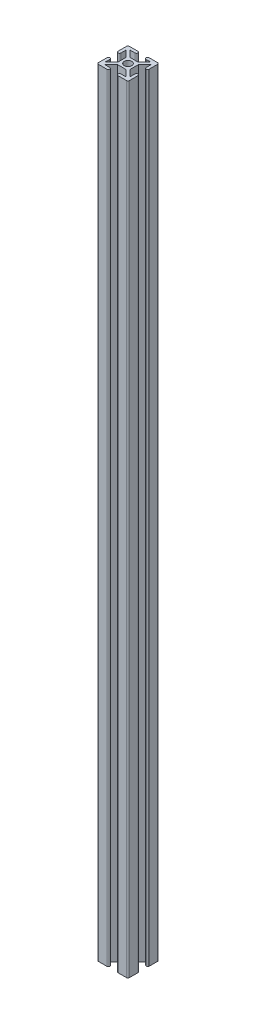
from build123d import *

# Parameters (mm, degrees)
CROQUIS1_R              = 3.645
SALIENTE_EXTRUIR1_DEPTH = 750
CROQUIS2_R              = 4
CORTAR_EXTRUIR1_DEPTH   = 750
CROQUIS3_R              = 4
CORTAR_EXTRUIR2_DEPTH   = 750
CROQUIS4_R              = 4
CORTAR_EXTRUIR3_DEPTH   = 750
CROQUIS5_R              = 4
CORTAR_EXTRUIR4_DEPTH   = 750
SKETCH1_R               = 3
CUT_EXTRUDE1_DEPTH      = 20


with BuildPart() as part:
    # Croquis1 → Saliente-Extruir1 (new body)
    with BuildSketch(Plane(origin=(0, 0, 0), x_dir=(1, 0, 0), z_dir=(0, 1, 0))):
        with BuildLine():
            Line((3.158007103, -5.963671526), (7.883007103, -5.963671526))
            Line((7.883007103, -5.963671526), (1.733007103, 0.186328474))
            Line((1.733007103, 0.186328474), (-6.266992897, 0.186328474))
            Line((-6.266992897, 0.186328474), (-12.416992897, -5.963671526))
            Line((-12.416992897, -5.963671526), (-7.691992897, -5.963671526))
            ThreePointArc((-7.691992897, -5.963671526), (-6.266992897, -7.388671526), (-7.691992897, -8.813671526))
            Line((-7.691992897, -8.813671526), (-15.868428669, -8.787235753))
            ThreePointArc((-15.868428669, -8.787235753), (-16.857362919, -8.377605775), (-17.266992897, -7.388671526))
            Line((-17.266992897, -7.388671526), (-17.266992897, 0.761328474))
            ThreePointArc((-17.266992897, 0.761328474), (-15.868428669, 2.159892701), (-14.469864442, 0.761328474))
            Line((-14.469864442, 0.761328474), (-14.469864442, -3.963671526))
            Line((-14.469864442, -3.963671526), (-8.319864442, 2.186328474))
            Line((-8.319864442, 2.186328474), (-8.319864442, 10.186328474))
            Line((-8.319864442, 10.186328474), (-14.469864442, 16.336328474))
            Line((-14.469864442, 16.336328474), (-14.469864442, 11.611328474))
            ThreePointArc((-14.469864442, 11.611328474), (-15.894864442, 10.186328474), (-17.319864442, 11.611328474))
            Line((-17.319864442, 11.611328474), (-17.319864442, 19.761281884))
            ThreePointArc((-17.319864442, 19.761281884), (-16.902491605, 20.768909047), (-15.894864442, 21.186281884))
            Line((-15.894864442, 21.186281884), (-7.744864442, 21.186281884))
            ThreePointArc((-7.744864442, 21.186281884), (-6.319864442, 19.761281884), (-7.744864442, 18.336281884))
            Line((-7.744864442, 18.336281884), (-12.469864442, 18.336281884))
            Line((-12.469864442, 18.336281884), (-6.319864442, 12.186281884))
            Line((-6.319864442, 12.186281884), (1.680135558, 12.186281884))
            Line((1.680135558, 12.186281884), (7.830135558, 18.336281884))
            Line((7.830135558, 18.336281884), (3.105135558, 18.336281884))
            ThreePointArc((3.105135558, 18.336281884), (1.680135558, 19.761281884), (3.105135558, 21.186281884))
            Line((3.105135558, 21.186281884), (11.255135558, 21.186281884))
            ThreePointArc((11.255135558, 21.186281884), (12.262762721, 20.768909047), (12.680135558, 19.761281884))
            Line((12.680135558, 19.761281884), (12.680135558, 11.71502557))
            ThreePointArc((12.680135558, 11.71502557), (11.255135558, 10.29002557), (9.830135558, 11.71502557))
            Line((9.830135558, 11.71502557), (9.830135558, 16.336281884))
            Line((9.830135558, 16.336281884), (3.680135558, 10.186281884))
            Line((3.680135558, 10.186281884), (3.680135558, 2.186281884))
            Line((3.680135558, 2.186281884), (9.830135558, -3.963718116))
            Line((9.830135558, -3.963718116), (9.830135558, 0.86502557))
            ThreePointArc((9.830135558, 0.86502557), (11.255135558, 2.29002557), (12.680135558, 0.86502557))
            Line((12.680135558, 0.86502557), (12.680135558, -7.388671526))
            ThreePointArc((12.680135558, -7.388671526), (12.262762721, -8.396298689), (11.255135558, -8.813671526))
            Line((11.255135558, -8.813671526), (3.158007103, -8.813671526))
            ThreePointArc((3.158007103, -8.813671526), (1.733007103, -7.388671526), (3.158007103, -5.963671526))
        make_face()
        with Locations(Location((-2.266992897, 6.186328474, 0), (0, 0, 270))):
            Circle(CROQUIS1_R, mode=Mode.SUBTRACT)
    extrude(amount=SALIENTE_EXTRUIR1_DEPTH)

    # Croquis2 → Cortar-Extruir1 (cut)
    with BuildSketch(Plane(origin=(3.680135558, 0, 0), x_dir=(0, 0, -1), z_dir=(1, 0, 0))):
        with Locations((6.186281884, 18.84)):
            Circle(CROQUIS2_R)
    extrude(amount=-CORTAR_EXTRUIR1_DEPTH, mode=Mode.SUBTRACT)

    # Croquis3 → Cortar-Extruir2 (cut)
    with BuildSketch(Plane.ZY.offset(8.319864442)):
        with Locations((-6.186281884, 75.14)):
            Circle(CROQUIS3_R)
    extrude(amount=-CORTAR_EXTRUIR2_DEPTH, mode=Mode.SUBTRACT)

    # Croquis4 → Cortar-Extruir3 (cut)
    with BuildSketch(Plane.ZY.offset(8.319864442)):
        with Locations((-6.186281884, 255.14)):
            Circle(CROQUIS4_R)
        with Locations((-6.186281884, 311.44)):
            Circle(CROQUIS4_R)
    extrude(amount=-CORTAR_EXTRUIR3_DEPTH, mode=Mode.SUBTRACT)

    # Croquis5 → Cortar-Extruir4 (cut)
    with BuildSketch(Plane.ZY.offset(8.319864442)):
        with Locations((-6.186281884, 198.84)):
            Circle(CROQUIS5_R)
    extrude(amount=-CORTAR_EXTRUIR4_DEPTH, mode=Mode.SUBTRACT)

    # Sketch1 → Cut-Extrude1 (cut)
    with BuildSketch(Plane.ZY.offset(8.319864442)):
        with Locations((-6.239200019, 735.00004659)):
            Circle(SKETCH1_R)
    extrude(amount=-CUT_EXTRUDE1_DEPTH, mode=Mode.SUBTRACT)


solid = part.part
